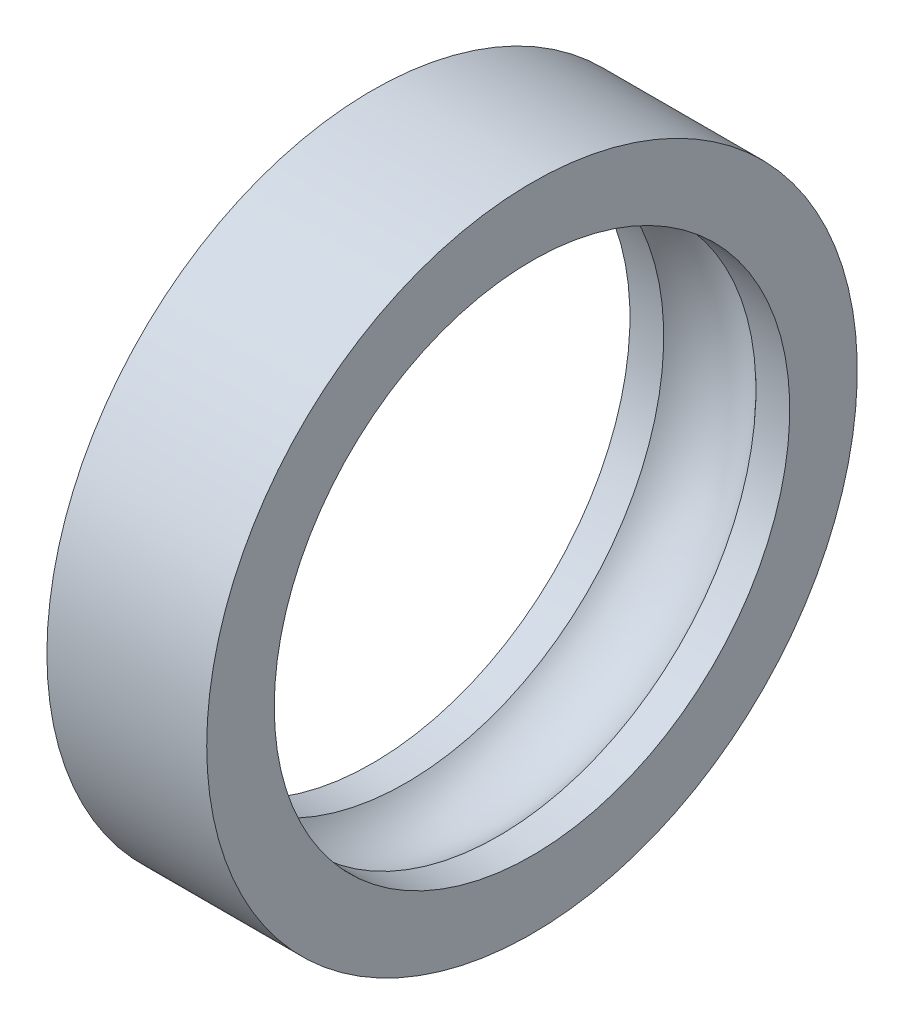
from build123d import *


with BuildPart() as part:
    # Sketch1 → Revolve3 (revolve)
    with BuildSketch(Plane.XY, mode=Mode.PRIVATE) as revolve3_sk:
        with BuildLine():
            Line((-15.5, 63.103092784), (15.5, 63.103092784))
            Line((15.5, 63.103092784), (15.5, 50.001221734))
            Line((15.5, 50.001221734), (8.94427191, 50))
            ThreePointArc((8.94427191, 50), (0, 54), (-8.94427191, 50))
            Line((-8.94427191, 50), (-15.5, 50))
            Line((-15.5, 50), (-15.5, 63.103092784))
        make_face()
    revolve(revolve3_sk.sketch.rotate(Axis((-33.636597938, 0, 0), (1, 0, 0)), 90), axis=Axis((-33.636597938, 0, 0), (1, 0, 0)))


solid = part.part
